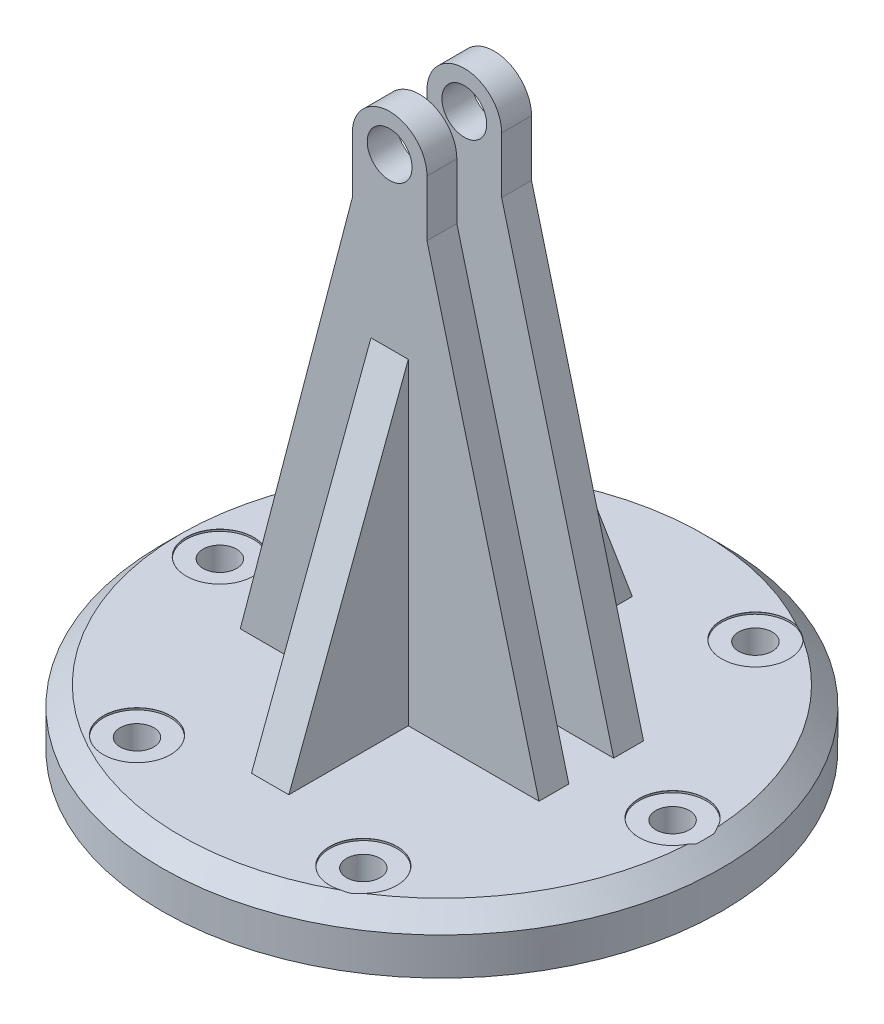
from build123d import *

# Parameters (mm, degrees)
SKETCH_2_R               = 75
EXTRUDE_1_DEPTH          = 15
SKETCH_3_R               = 6
EXTRUDE_2_DEPTH          = 14
CUT_EXTRUDE_2_DEPTH      = 188.81639971
CUT_EXTRUDE_2_DEPTH_BACK = 188.81639971
SKETCH_4_W               = 12
SKETCH_4_H               = 150
SKETCH_5_R               = 40
CUT_EXTRUDE_3_DEPTH      = 7.5
CHAMFER_2_SIZE           = 5
RIB_21_REACH             = 189.816
SKETCH_8_WALL_W          = 468.456805058
SKETCH_8_WALL_H          = 10
PATTERN_CIRCULAR_3_COUNT = 6


with BuildPart() as part:
    # 草图2 → 凸台-拉伸1 (new body)
    with BuildSketch(Plane(origin=(0, 0, 0), x_dir=(1, 0, 0), z_dir=(0, 1, 0))):
        with Locations(Location((0, 0, 0), (0, 0, 270))):
            Circle(SKETCH_2_R)
    extrude(amount=EXTRUDE_1_DEPTH)

    # 草图3 → 凸台-拉伸2 (add, symmetric)
    with BuildSketch(Plane.XY):
        with BuildLine():
            Line((10, 145), (10, 130))
            Line((10, 130), (40, 15))
            Line((40, 15), (-40, 15))
            Line((-40, 15), (-10, 130))
            Line((-10, 130), (-10, 145))
            ThreePointArc((-10, 145), (0, 155), (10, 145))
        make_face()
        with Locations((0, 145)):
            Circle(SKETCH_3_R, mode=Mode.SUBTRACT)
    extrude(amount=EXTRUDE_2_DEPTH, both=True)

    # 草图4 → 切除-拉伸2 (cut, two sides: drawn at the far end of the back side and taken through both)
    with BuildSketch(Plane(origin=(0, 0, 0), x_dir=(0, 0, -1), z_dir=(1, 0, 0)).offset(-CUT_EXTRUDE_2_DEPTH_BACK)):
        with Locations((0, 90)):
            Rectangle(SKETCH_4_W, SKETCH_4_H)
    extrude(amount=CUT_EXTRUDE_2_DEPTH + CUT_EXTRUDE_2_DEPTH_BACK, mode=Mode.SUBTRACT)

    # 草图5 → 切除-拉伸3 (cut)
    with BuildSketch(Plane(origin=(0, 0, 0), x_dir=(1, 0, 0), z_dir=(0, 1, 0))):
        with Locations(Location((0, 0, 0), (0, 0, 270))):
            Circle(SKETCH_5_R)
    extrude(amount=CUT_EXTRUDE_3_DEPTH, mode=Mode.SUBTRACT)

    # 倒角2
    chamfer_2_edges = [part.edges().sort_by_distance(p)[0] for p in [
        (0, 15, -75),
    ]]
    chamfer(chamfer_2_edges, length=CHAMFER_2_SIZE)

    # 草图8 wall → 筋21 (add, up to next)
    with BuildSketch(Plane(origin=(0, 57.5, 30), x_dir=(0, -0.935875921829, 0.352329758806), z_dir=(0, -0.352329758806, -0.935875921829)), mode=Mode.PRIVATE) as rib_21_sk1:
        Rectangle(SKETCH_8_WALL_W, SKETCH_8_WALL_H)
    rib_21_tool1 = extrude(rib_21_sk1.sketch, amount=RIB_21_REACH, mode=Mode.PRIVATE) - part.part
    rib_21 = rib_21_tool1.solids().sort_by_distance((0, 57.5, 30))[0]
    add(rib_21)

    # 镜向1: 筋21 across plane
    add(rib_21.mirror(Plane.XY))

    # 草图24 → M8 六角头螺栓C级的柱形沉头孔7 (revolve, cut)
    with BuildSketch(Plane(origin=(-59.477689935, 15, 0), x_dir=(0, 0, 1), z_dir=(1, 0, 0))):
        Polygon((0, 0), (0, 15), (4.5, 15), (4.5, 0.5), (9, 0.5), (9, 0.020977491), (9.025, 0), align=None)
    m8_c_7 = revolve(axis=Axis((-59.477689935, 21.35, 0), (0, -1, 0)), mode=Mode.SUBTRACT)

    # 阵列(圆周)3: M8 六角头螺栓C级的柱形沉头孔7 ×6 about axis
    pattern_circular_3_axis = Axis((1.151424032, 0, 0), (0, 1, 0))
    for i in range(1, PATTERN_CIRCULAR_3_COUNT):
        add(m8_c_7.rotate(pattern_circular_3_axis, i * 360 / PATTERN_CIRCULAR_3_COUNT), mode=Mode.SUBTRACT)


solid = part.part
